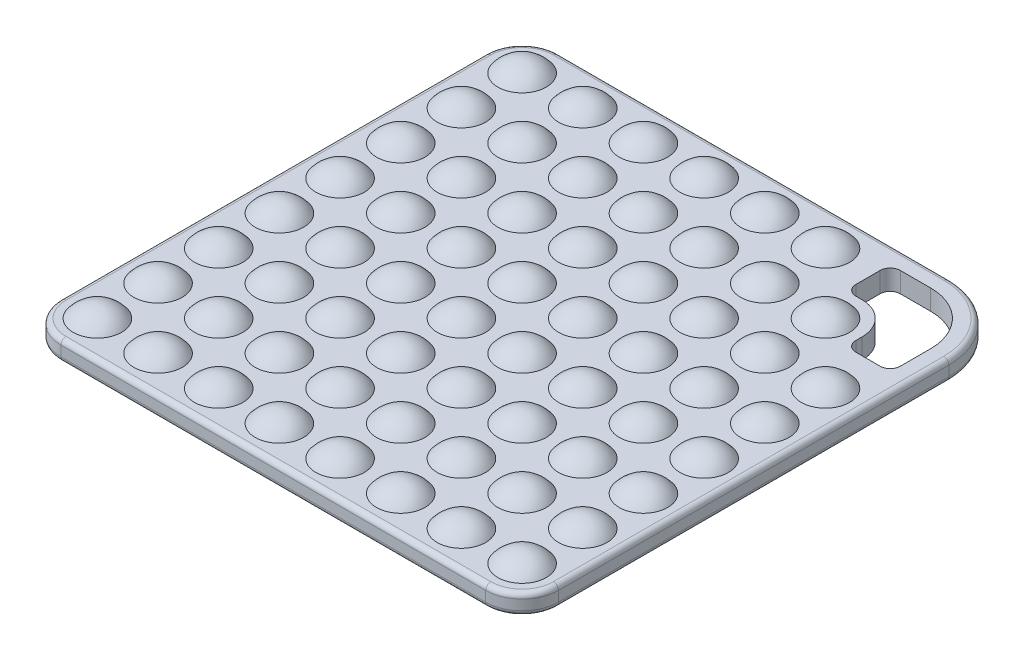
from build123d import *

# Parameters (mm, degrees)
BOSS_EXTRUDE1_DEPTH  = 10
CUT_EXTRUDE1_REACH   = 176.235
FILLET1_R            = 2.5
LPATTERN1_COUNT      = 8
LPATTERN1_PITCH      = 30
LPATTERN1_COUNT_DIR2 = 8
LPATTERN1_PITCH_DIR2 = 30


with BuildPart() as part:
    # Sketch1 → Boss-Extrude1 (new body)
    with BuildSketch(Plane(origin=(0, 0, 0), x_dir=(1, 0, 0), z_dir=(0, 1, 0))):
        with BuildLine():
            Line((-105, 123), (88, 123))
            ThreePointArc((88, 123), (112.748737342, 112.748737342), (123, 88))
            Line((123, 88), (123, -105))
            ThreePointArc((123, -105), (117.727922061, -117.727922061), (105, -123))
            Line((105, -123), (-105, -123))
            ThreePointArc((-105, -123), (-117.727922061, -117.727922061), (-123, -105))
            Line((-123, -105), (-123, 105))
            ThreePointArc((-123, 105), (-117.727922061, 117.727922061), (-105, 123))
        make_face()
    extrude(amount=BOSS_EXTRUDE1_DEPTH)

    # Sketch4 → Cut-Extrude1 (cut, up to next)
    with BuildSketch(Plane(origin=(0, 10, 0), x_dir=(1, 0, 0), z_dir=(0, 1, 0)), mode=Mode.PRIVATE) as cut_extrude1_sk1:
        with BuildLine():
            Line((92, 76), (92, 73))
            ThreePointArc((92, 73), (93.464466094, 69.464466094), (97, 68))
            Line((97, 68), (109, 68))
            ThreePointArc((109, 68), (112.535533906, 69.464466094), (114, 73))
            Line((114, 73), (114, 88))
            ThreePointArc((114, 88), (106.384776311, 106.384776311), (88, 114))
            Line((88, 114), (73, 114))
            ThreePointArc((73, 114), (69.464466094, 112.535533906), (68, 109))
            Line((68, 109), (68, 97))
            ThreePointArc((68, 97), (69.464466094, 93.464466094), (73, 92))
            Line((73, 92), (76, 92))
            ThreePointArc((76, 92), (87.313708499, 87.313708499), (92, 76))
        make_face()
    cut_extrude1_tool1 = extrude(cut_extrude1_sk1.sketch, amount=-CUT_EXTRUDE1_REACH, mode=Mode.PRIVATE) & part.part
    add(cut_extrude1_tool1.solids().sort_by_distance((93.664872, 10, -93.664872))[0], mode=Mode.SUBTRACT)

    # Fillet1
    fillet1_edges = [part.edges().sort_by_distance(p)[0] for p in [
        (-8.5, 0, -123),
        (112.748737342, 0, -112.748737342),
        (123, 0, 8.5),
        (117.727922061, 0, 117.727922061),
        (112.748737342, 10, -112.748737342),
        (-8.5, 10, -123),
        (-117.727922061, 10, -117.727922061),
        (-123, 10, 0),
        (-117.727922061, 10, 117.727922061),
        (0, 10, 123),
        (117.727922061, 10, 117.727922061),
        (0, 0, 123),
        (123, 10, 8.5),
        (-117.727922061, 0, 117.727922061),
        (-123, 0, 0),
        (-117.727922061, 0, -117.727922061),
    ]]
    fillet(fillet1_edges, radius=FILLET1_R)

    # Sketch5 → Revolve1 (revolve)
    with BuildSketch(Plane.XY.offset(105)):
        with BuildLine():
            Line((105, 10), (105, 16))
            ThreePointArc((105, 16), (111.708203932, 14.416407865), (117, 10))
            Line((117, 10), (105, 10))
        make_face()
    revolve1 = revolve(axis=Axis((105, 10, 105), (0, 1, 0)))

    # LPattern1: Revolve1 8 × 8, 3 skipped
    with Locations(*[(-i * LPATTERN1_PITCH, 0, -j * LPATTERN1_PITCH_DIR2) for i in range(LPATTERN1_COUNT) for j in range(LPATTERN1_COUNT_DIR2) if (i, j) not in ((0, 0), (0, 6), (0, 7), (1, 7))]):
        add(revolve1)


solid = part.part
